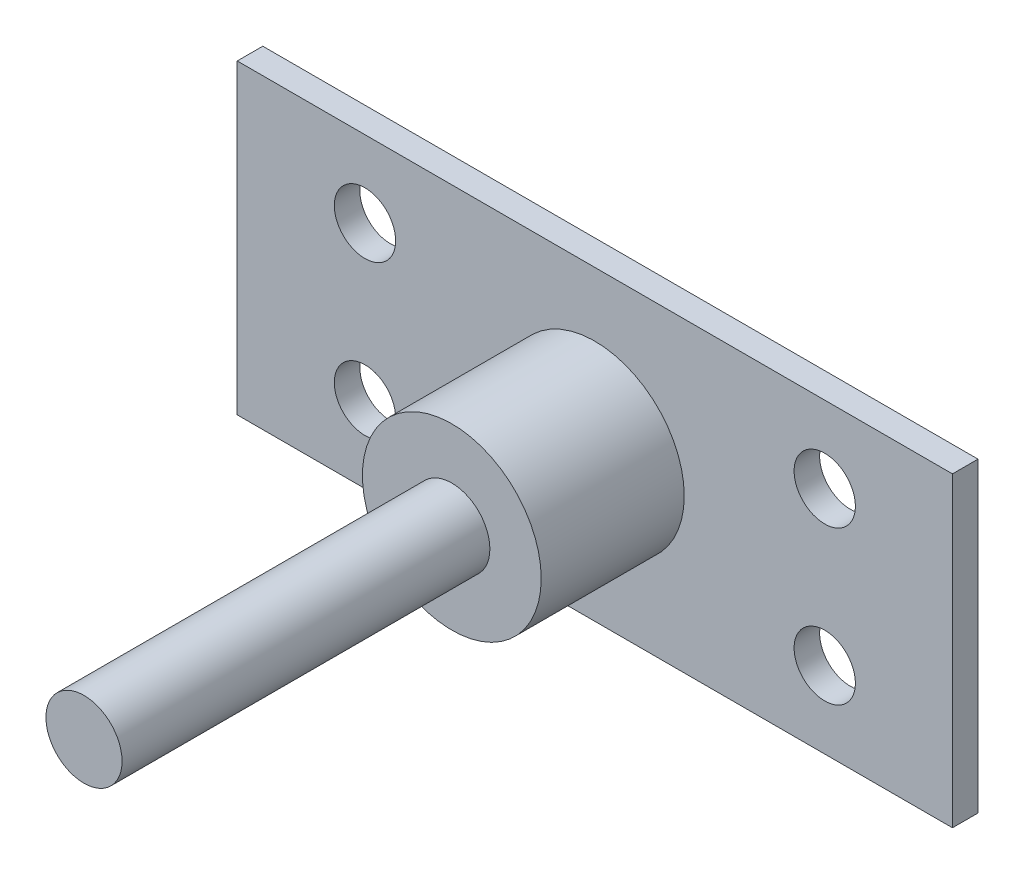
from build123d import *

# Parameters (mm, degrees)
SKETCH1_W                = 140
SKETCH1_H                = 60
BOSS_EXTRUDE1_DEPTH      = 5
SKETCH2_R                = 7.45
SKETCH2_R_2              = 6
CUT_EXTRUDE1_DEPTH       = 5
BOSS_EXTRUDE3_DEPTH      = 100
BOSS_EXTRUDE3_DEPTH_BACK = 5
SKETCH3_R                = 7.45
SKETCH4_R                = 17.5
BOSS_EXTRUDE4_DEPTH      = 28


with BuildPart() as part:
    # Sketch1 → Boss-Extrude1 (new body)
    with BuildSketch(Plane.XY):
        Rectangle(SKETCH1_W, SKETCH1_H)
    extrude(amount=BOSS_EXTRUDE1_DEPTH)

    # Sketch2 → Cut-Extrude1 (cut)
    with BuildSketch(Plane.XY.offset(5)):
        Circle(SKETCH2_R)
        with Locations((-45, 15)):
            Circle(SKETCH2_R_2)
        with Locations((45, 15)):
            Circle(SKETCH2_R_2)
        with Locations((-45, -15)):
            Circle(SKETCH2_R_2)
        with Locations((45, -15)):
            Circle(SKETCH2_R_2)
    extrude(amount=-CUT_EXTRUDE1_DEPTH, mode=Mode.SUBTRACT)

    # Sketch3 → Boss-Extrude3 (add, two sides: drawn at the far end of the back side and taken through both)
    with BuildSketch(Plane.XY.offset(5).offset(-BOSS_EXTRUDE3_DEPTH_BACK)):
        Circle(SKETCH3_R)
    extrude(amount=BOSS_EXTRUDE3_DEPTH + BOSS_EXTRUDE3_DEPTH_BACK)

    # Sketch4 → Boss-Extrude4 (add)
    with BuildSketch(Plane.XY.offset(5)):
        Circle(SKETCH4_R)
    extrude(amount=BOSS_EXTRUDE4_DEPTH)


solid = part.part
